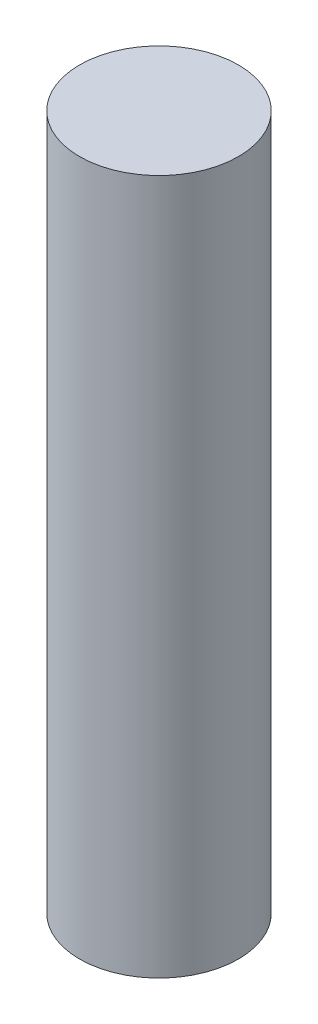
from build123d import *

# Parameters (mm, degrees)
SKETCH_1_R      = 4
EXTRUDE_1_DEPTH = 35


with BuildPart() as part:
    # 草图1 → 凸台-拉伸1 (new body)
    with BuildSketch(Plane(origin=(0, 0, 0), x_dir=(1, 0, 0), z_dir=(0, 1, 0))):
        with Locations(Location((0, 0, 0), (0, 0, 270))):
            Circle(SKETCH_1_R)
    extrude(amount=EXTRUDE_1_DEPTH)


solid = part.part
